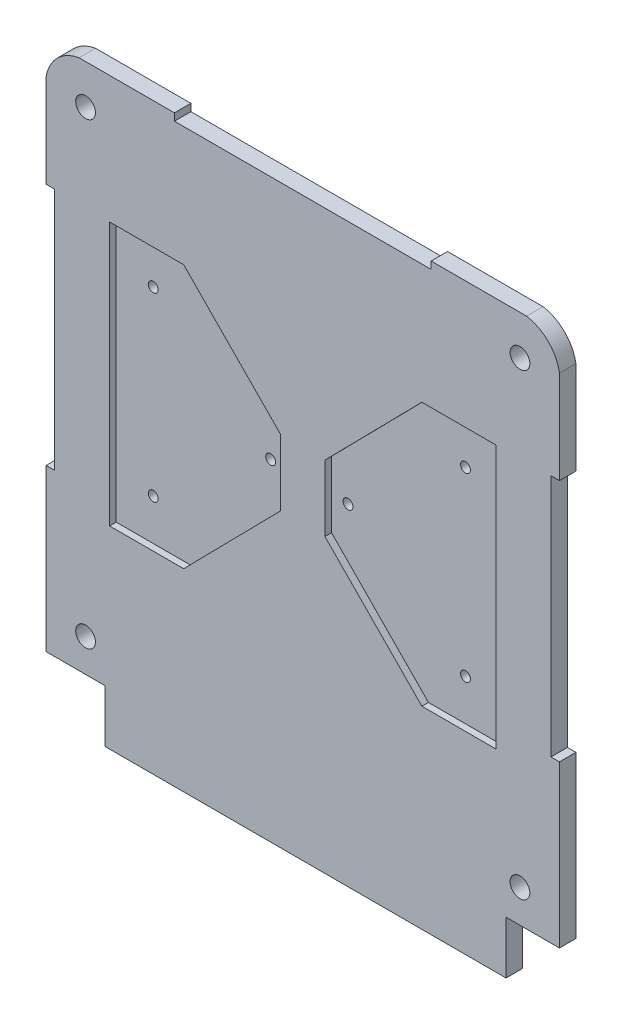
from build123d import *

# Parameters (mm, degrees)
BOSS_EXTRUDE1_DEPTH = 5
CUT_EXTRUDE1_DEPTH  = 2
SKETCH3_R           = 3
CUT_EXTRUDE2_DEPTH  = 42
SKETCH6_W           = 4
SKETCH6_H           = 4
SKETCH6_W_2         = 3.999984741
CUT_EXTRUDE4_DEPTH  = 3
CUT_EXTRUDE5_DEPTH  = 3
SKETCH8_W           = 121.9
SKETCH8_H           = 16
BOSS_EXTRUDE2_DEPTH = 5
SKETCH10_R          = 1.5
CUT_EXTRUDE6_DEPTH  = 10


with BuildPart() as part:
    # Sketch1 → Boss-Extrude1 (new body)
    with BuildSketch(Plane.XY):
        with BuildLine():
            Line((-75.420043945, 42.350021362), (-75.420043945, -31.650009155))
            Line((-75.420043945, -31.650009155), (-78, -31.650009155))
            Line((-78, -31.650009155), (-78, -80.650009155))
            Line((-78, -80.650009155), (78, -80.650009155))
            Line((78, -80.650009155), (78, -31.650009155))
            Line((78, -31.650009155), (75.419921875, -31.650009155))
            Line((75.419921875, -31.650009155), (75.419921875, 42.350021362))
            Line((75.419921875, 42.350021362), (78, 42.350021362))
            Line((78, 42.350021362), (78, 70.650009155))
            ThreePointArc((78, 70.650009155), (74.602310181, 77.252319336), (68, 80.650009155))
            Line((68, 80.650009155), (39, 80.650009155))
            Line((39, 80.650009155), (39, 78.449996948))
            Line((39, 78.449996948), (-39, 78.449996948))
            Line((-39, 78.449996948), (-39, 80.650009155))
            Line((-39, 80.650009155), (-68, 80.650009155))
            ThreePointArc((-68, 80.650009155), (-74.602340698, 77.252349854), (-78, 70.650009155))
            Line((-78, 70.650009155), (-78, 42.350021362))
            Line((-78, 42.350021362), (-75.420043945, 42.350021362))
        make_face()
    extrude(amount=BOSS_EXTRUDE1_DEPTH)

    # Sketch2 → Cut-Extrude1 (cut)
    with BuildSketch(Plane.XY.offset(5)):
        Polygon((-6.739431127, -7.975087618), (-6.739431127, 12.139103822), (-36.191468123, 42.082008102), (-58.691468123, 42.082008102), (-58.691468123, 2.082008102), (-58.691468123, -37.917991898), (-36.191468123, -37.917991898), align=None)
        Polygon((6.739431127, 12.139103822), (36.191468123, 42.082008102), (58.691468123, 42.082008102), (58.691468123, 2.082008102), (58.691468123, -37.917991898), (36.191468123, -37.917991898), (6.739431127, -7.975087618), align=None)
    extrude(amount=-CUT_EXTRUDE1_DEPTH, mode=Mode.SUBTRACT)

    # Sketch3 → Cut-Extrude2 (cut)
    with BuildSketch(Plane.XY.offset(5)):
        with Locations((-66.000082844, 68.650091999)):
            Circle(SKETCH3_R)
        with Locations((65.999919006, 68.649928161)):
            Circle(SKETCH3_R)
        with Locations((-66.000082844, -70.650009155)):
            Circle(SKETCH3_R)
        with Locations((65.999919006, -70.650009155)):
            Circle(SKETCH3_R)
    extrude(amount=-CUT_EXTRUDE2_DEPTH, mode=Mode.SUBTRACT)

    # Sketch6 → Cut-Extrude4 (cut)
    with BuildSketch(Plane(origin=(0, 0, 0), x_dir=(-1, 0, 0), z_dir=(0, 0, -1))):
        with Locations((-61.995116115, -61.665595666)):
            Rectangle(SKETCH6_W, SKETCH6_H)
        with Locations((63.504872442, -61.665595666)):
            Rectangle(SKETCH6_W_2, SKETCH6_H)
    extrude(amount=-CUT_EXTRUDE4_DEPTH, mode=Mode.SUBTRACT)

    # Sketch7 → Cut-Extrude5 (cut)
    with BuildSketch(Plane(origin=(0, 0, 0), x_dir=(-1, 0, 0), z_dir=(0, 0, -1))):
        Polygon((-63.995116115, -59.665595666), (-63.995116115, 47.660531993), (65.504864812, 47.660531993), (65.504864812, -59.665595666), (61.504880071, -59.665595666), (61.504880071, 44.476086648), (-59.995116115, 44.476086648), (-59.995116115, -59.665595666), align=None)
    extrude(amount=-CUT_EXTRUDE5_DEPTH, mode=Mode.SUBTRACT)

    # Sketch8 → Boss-Extrude2 (add)
    with BuildSketch(Plane(origin=(0, 0, 0), x_dir=(-1, 0, 0), z_dir=(0, 0, -1))):
        with Locations((-0.820022175, -88.650009155)):
            Rectangle(SKETCH8_W, SKETCH8_H)
    extrude(amount=-BOSS_EXTRUDE2_DEPTH)

    # Sketch10 → Cut-Extrude6 (cut)
    with BuildSketch(Plane.XY.offset(3)):
        with Locations((-47.441468123, 29.582008102)):
            Circle(SKETCH10_R)
        with Locations((-47.441468123, -25.417991898)):
            Circle(SKETCH10_R)
        with Locations((-11.759431127, 2.082008102)):
            Circle(SKETCH10_R)
        with Locations((11.759431127, 2.082008102)):
            Circle(SKETCH10_R)
        with Locations((47.441468123, -25.417991898)):
            Circle(SKETCH10_R)
        with Locations((47.441468123, 29.582008102)):
            Circle(SKETCH10_R)
    extrude(amount=-CUT_EXTRUDE6_DEPTH, mode=Mode.SUBTRACT)


solid = part.part
